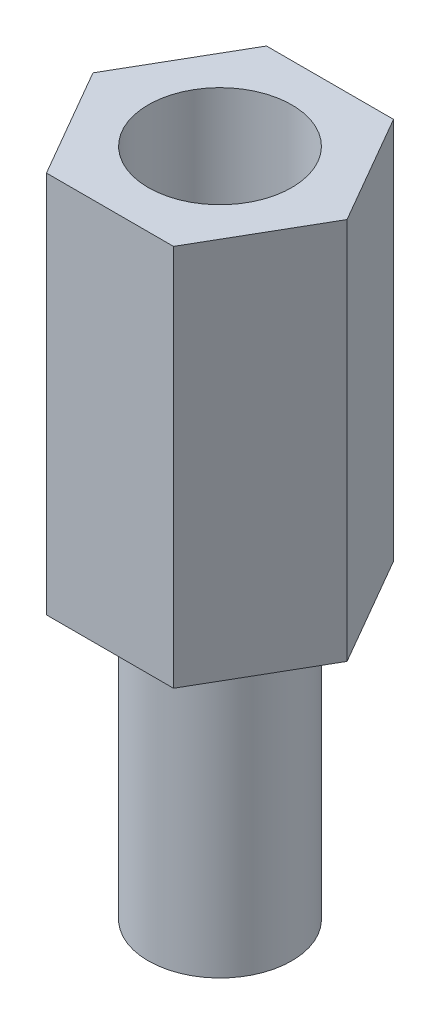
from build123d import *

# Parameters (mm, degrees)
HEX_PART_DEPTH   = 8
SKETCH2_R        = 1.5
THREAD_DEPTH     = 6
SKETCH3_R        = 1.5
HEX_THREAD_DEPTH = 6


with BuildPart() as part:
    # Sketch1 → HEX PART (new body)
    with BuildSketch(Plane(origin=(0, 0, 0), x_dir=(1, 0, 0), z_dir=(0, 1, 0))):
        Polygon((2.655811238, 0), (1.327905619, 2.3), (-1.327905619, 2.3), (-2.655811238, 0), (-1.327905619, -2.3), (1.327905619, -2.3), align=None)
    extrude(amount=HEX_PART_DEPTH)

    # Sketch2 → THREAD (add)
    with BuildSketch(Plane(origin=(0, 0, 0), x_dir=(1, 0, 0), z_dir=(0, 1, 0))):
        with Locations(Location((0, 0, 0), (0, 0, 270))):
            Circle(SKETCH2_R)
    extrude(amount=-THREAD_DEPTH)

    # Sketch3 → HEX THREAD (cut)
    with BuildSketch(Plane(origin=(0, 8, 0), x_dir=(1, 0, 0), z_dir=(0, 1, 0))):
        with Locations(Location((0, 0, 0), (0, 0, 270))):
            Circle(SKETCH3_R)
    extrude(amount=-HEX_THREAD_DEPTH, mode=Mode.SUBTRACT)


solid = part.part
